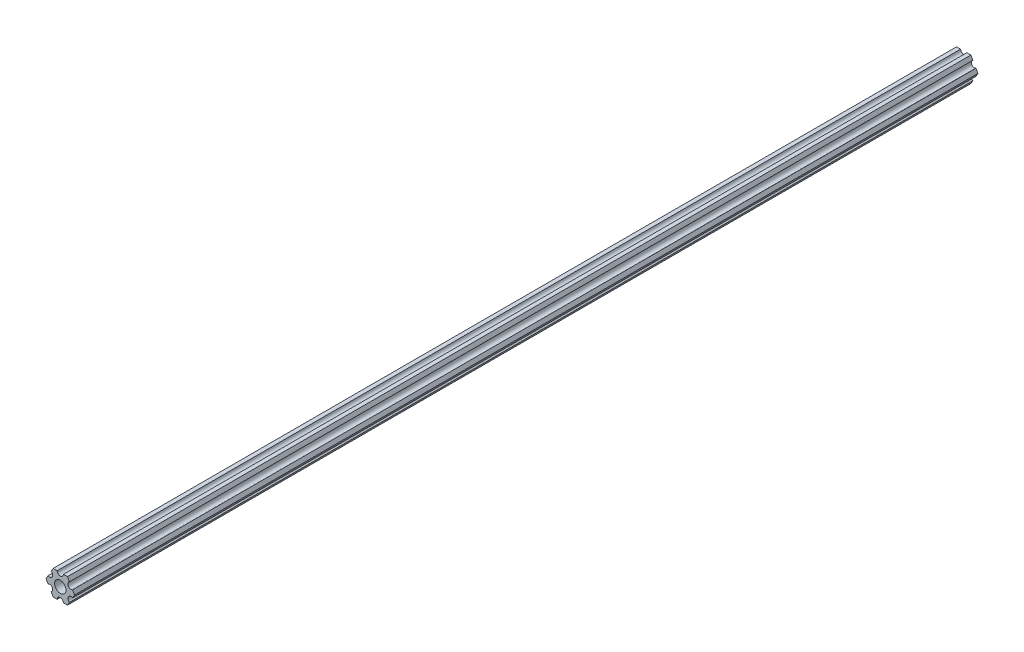
from build123d import *

# Parameters (mm, degrees)
SKETCH1_R           = 2.9337
BOSS_EXTRUDE1_DEPTH = 231.775


with BuildPart() as part:
    # Sketch1 → Boss-Extrude1 (new, symmetric)
    with BuildSketch(Plane.XY):
        with BuildLine():
            Line((-1.587500385, 6.349999904), (-3.666174594, 6.349999778))
            Line((-3.666174594, 6.349999778), (-4.70551159, 4.549815043))
            ThreePointArc((-4.70551159, 4.549815043), (-4.12444613, 2.38124975), (-6.293011423, 1.80018429))
            Line((-6.293011423, 1.80018429), (-7.332348419, -4.44e-07))
            Line((-7.332348419, -4.44e-07), (-6.293011205, -1.800185053))
            ThreePointArc((-6.293011205, -1.800185053), (-4.124445841, -2.38125025), (-4.705511038, -4.549815614))
            Line((-4.705511038, -4.549815614), (-3.666173825, -6.350000222))
            Line((-3.666173825, -6.350000222), (-1.587499615, -6.350000096))
            ThreePointArc((-1.587499615, -6.350000096), (2.89e-07, -4.7625), (1.587500385, -6.349999904))
            Line((1.587500385, -6.349999904), (3.666174594, -6.349999778))
            Line((3.666174594, -6.349999778), (4.70551159, -4.549815043))
            ThreePointArc((4.70551159, -4.549815043), (4.12444613, -2.38124975), (6.293011423, -1.80018429))
            Line((6.293011423, -1.80018429), (7.332348419, 4.44e-07))
            Line((7.332348419, 4.44e-07), (6.293011205, 1.800185053))
            ThreePointArc((6.293011205, 1.800185053), (4.124445841, 2.38125025), (4.705511038, 4.549815614))
            Line((4.705511038, 4.549815614), (3.666173825, 6.350000222))
            Line((3.666173825, 6.350000222), (1.587499615, 6.350000096))
            ThreePointArc((1.587499615, 6.350000096), (-2.89e-07, 4.7625), (-1.587500385, 6.349999904))
        make_face()
        Circle(SKETCH1_R, mode=Mode.SUBTRACT)
    extrude(amount=BOSS_EXTRUDE1_DEPTH, both=True)


solid = part.part
